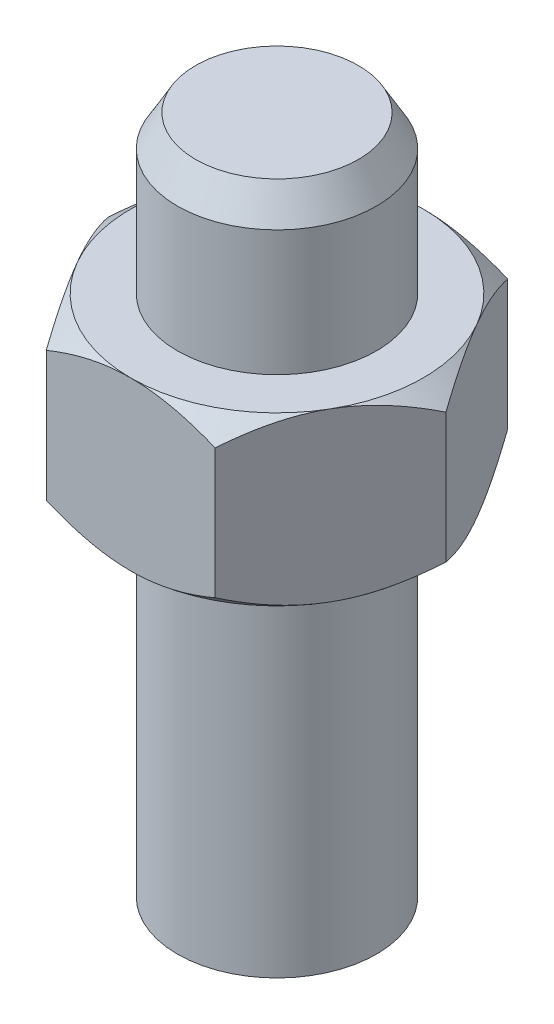
from build123d import *

# Parameters (mm, degrees)
CROQUIS1_R              = 9.525
SALIENTE_EXTRUIR1_DEPTH = 50
SALIENTE_EXTRUIR2_START = -16
CROQUIS3_R              = 9.525
SALIENTE_EXTRUIR2_DEPTH = 16
CROQUIS4_R              = 9.525
SALIENTE_EXTRUIR3_DEPTH = 15
CHAFL_N1_SIZE           = 3
CHAFL_N1_SIZE2          = 1.732050808
CROQUIS5_R              = 52.693762875
CROQUIS5_R_2            = 14
CORTAR_EXTRUIR1_DEPTH   = 15
CORTAR_EXTRUIR1_DRAFT   = -51
CROQUIS6_R              = 45.15885801
CROQUIS6_R_2            = 14
CORTAR_EXTRUIR2_DEPTH   = 15
CORTAR_EXTRUIR2_DRAFT   = -50


with BuildPart() as part:
    # Croquis1 → Saliente-Extruir1 (new body)
    with BuildSketch(Plane(origin=(0, 0, 0), x_dir=(1, 0, 0), z_dir=(0, 1, 0))):
        with Locations(Location((0, 0, 0), (0, 0, 270))):
            Circle(CROQUIS1_R)
    extrude(amount=SALIENTE_EXTRUIR1_DEPTH)

    # Croquis3 → Saliente-Extruir2 (add)
    with BuildSketch(Plane(origin=(0, 50, 0), x_dir=(1, 0, 0), z_dir=(0, 1, 0)).offset(SALIENTE_EXTRUIR2_START)):
        Polygon((16.165807537, 0), (8.082903769, 14), (-8.082903769, 14), (-16.165807537, 0), (-8.082903769, -14), (8.082903769, -14), align=None)
        with Locations(Location((0, 0, 0), (0, 0, 270))):
            Circle(CROQUIS3_R, mode=Mode.SUBTRACT)
    extrude(amount=SALIENTE_EXTRUIR2_DEPTH)

    # Croquis4 → Saliente-Extruir3 (add)
    with BuildSketch(Plane(origin=(0, 50, 0), x_dir=(1, 0, 0), z_dir=(0, 1, 0))):
        with Locations(Location((0, 0, 0), (0, 0, 270))):
            Circle(CROQUIS4_R)
    extrude(amount=SALIENTE_EXTRUIR3_DEPTH)

    # Chaflán1
    chafl_n1_edges = [part.edges().sort_by_distance(p)[0] for p in [
        (0, 65, -9.525),
    ]]
    chafl_n1_side = [part.faces().sort_by_distance(p)[0] for p in [
        (0, 57.5, -9.525),
    ]]
    chamfer(chafl_n1_edges, length=CHAFL_N1_SIZE, length2=CHAFL_N1_SIZE2, reference=chafl_n1_side[0])


with BuildPart() as cortar_extruir1_tool:
    # Croquis5 → Cortar-Extruir1 (with draft: the straight prism first)
    with BuildSketch(Plane(origin=(0, 50, 0), x_dir=(1, 0, 0), z_dir=(0, 1, 0))):
        Circle(CROQUIS5_R)
        Circle(CROQUIS5_R_2, mode=Mode.SUBTRACT)
    extrude(amount=-CORTAR_EXTRUIR1_DEPTH)
    # Cortar-Extruir1: the draft: its side faces are tilted about the plane it starts from
    cortar_extruir1_sides = [cortar_extruir1_tool.faces().sort_by_distance(p)[0] for p in [
        (-52.693762875, 42.5, 0),
        (-14, 42.5, 0),
    ]]
    draft(cortar_extruir1_sides, Plane(origin=(0, 50, 0), x_dir=(1, 0, 0), z_dir=(0, 1, 0)), CORTAR_EXTRUIR1_DRAFT)


with BuildPart() as part_1:
    add(part.part)

    # Cortar-Extruir1: cut by cortar_extruir1_tool
    add(cortar_extruir1_tool.part, mode=Mode.SUBTRACT)


with BuildPart() as cortar_extruir2_tool:
    # Croquis6 → Cortar-Extruir2 (with draft: the straight prism first)
    with BuildSketch(Plane.XZ.offset(-34)):
        Circle(CROQUIS6_R)
        Circle(CROQUIS6_R_2, mode=Mode.SUBTRACT)
    extrude(amount=-CORTAR_EXTRUIR2_DEPTH)
    # Cortar-Extruir2: the draft: its side faces are tilted about the plane it starts from
    cortar_extruir2_sides = [cortar_extruir2_tool.faces().sort_by_distance(p)[0] for p in [
        (-45.15885801, 41.5, 0),
        (-14, 41.5, 0),
    ]]
    draft(cortar_extruir2_sides, Plane.XZ.offset(-34), CORTAR_EXTRUIR2_DRAFT)


with BuildPart() as part_2:
    add(part_1.part)

    # Cortar-Extruir2: cut by cortar_extruir2_tool
    add(cortar_extruir2_tool.part, mode=Mode.SUBTRACT)


solid = part_2.part
